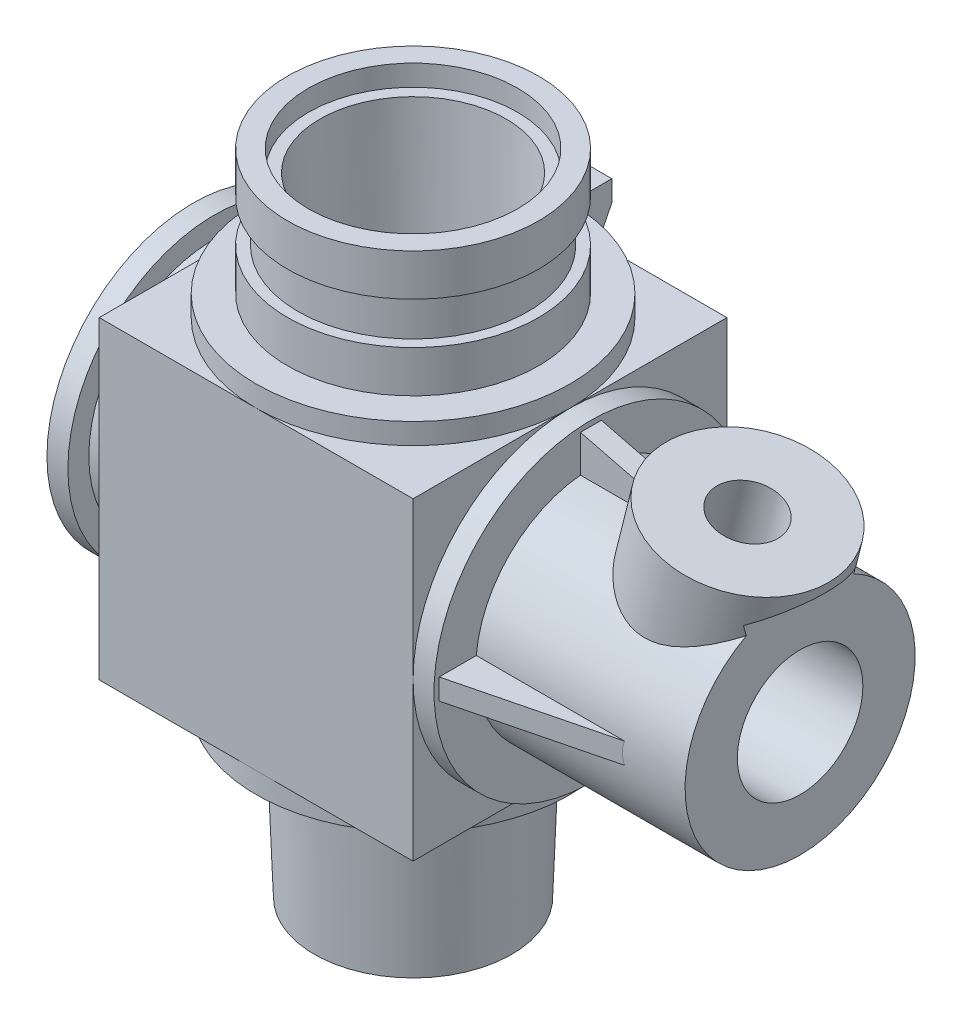
from build123d import *

# Parameters (mm, degrees)
SKETCH1_W                 = 15
SKETCH1_H                 = 15
BOSS_EXTRUDE2_DEPTH       = 15
SKETCH3_R                 = 7.5
BOSS_EXTRUDE3_DEPTH       = 1
SKETCH4_R                 = 6
BOSS_EXTRUDE4_DEPTH       = 2
SKETCH5_R                 = 5.5
BOSS_EXTRUDE5_DEPTH       = 2
SKETCH6_R                 = 6
BOSS_EXTRUDE6_DEPTH       = 2
BOSS_EXTRUDE7_START       = 1
SKETCH7_R                 = 7.5
BOSS_EXTRUDE7_DEPTH       = 1
SKETCH8_R                 = 5
BOSS_EXTRUDE8_DEPTH       = 8
BOSS_EXTRUDE8_TAPER       = 2
SKETCH9_R                 = 3.5
CUT_EXTRUDE1_DEPTH        = 21
SKETCH18_R                = 7.5
BOSS_EXTRUDE11_DEPTH      = 1
SKETCH19_R                = 5.5
BOSS_EXTRUDE12_DEPTH      = 10
SKETCH23_R                = 6
BOSS_EXTRUDE14_DEPTH      = 2
SKETCH24_R                = 7
BOSS_EXTRUDE15_DEPTH      = 1
SKETCH29_R                = 5.5
CUT_EXTRUDE5_DEPTH        = 17
SKETCH30_R                = 3
CUT_EXTRUDE6_DEPTH        = 18
SKETCH40_R                = 4.5
CUT_EXTRUDE10_DEPTH       = 11
CUT_EXTRUDE10_DRAFT       = -2.9
SKETCH41_R                = 5
CUT_EXTRUDE11_DEPTH       = 1
SKETCH42_W                = 7.5
SKETCH42_H                = 2
BOSS_EXTRUDE17_DEPTH      = 1
BOSS_EXTRUDE18_DEPTH      = 7.5
SKETCH47_R                = 3
CUT_EXTRUDE12_DEPTH       = 4
SKETCH48_R                = 1
CUT_EXTRUDE13_DEPTH       = 7
RIB2_REACH                = 34.226
SKETCH51_WALL_W           = 74.69774353
SKETCH51_WALL_H           = 1
CIRPATTERN2_COUNT         = 4
BOSS_EXTRUDE19_DEPTH      = 3
BOSS_EXTRUDE19_DEPTH_BACK = 2
SKETCH53_R                = 4
CUT_EXTRUDE15_START       = 3
SKETCH28_R                = 6
CUT_EXTRUDE15_DEPTH       = 3
SKETCH54_R                = 1.5
CUT_EXTRUDE16_DEPTH       = 7
RIB3_REACH                = 35.337
SKETCH55_WALL_W           = 72.920893998
SKETCH55_WALL_H           = 1
SKETCH56_R                = 3
CUT_EXTRUDE17_DEPTH       = 7


with BuildPart() as part:
    # Sketch1 → Boss-Extrude2 (new body)
    with BuildSketch(Plane(origin=(0, 0, 0), x_dir=(0, 0, -1), z_dir=(1, 0, 0))):
        Rectangle(SKETCH1_W, SKETCH1_H)
    extrude(amount=BOSS_EXTRUDE2_DEPTH)

    # Sketch3 → Boss-Extrude3 (add)
    with BuildSketch(Plane(origin=(0, 7.5, 0), x_dir=(1, 0, 0), z_dir=(0, 1, 0))):
        with Locations(Location((7.5, 0, 0), (0, 0, 270))):
            Circle(SKETCH3_R)
    extrude(amount=BOSS_EXTRUDE3_DEPTH)

    # Sketch4 → Boss-Extrude4 (add)
    with BuildSketch(Plane(origin=(0, 8.5, 0), x_dir=(1, 0, 0), z_dir=(0, 1, 0))):
        with Locations(Location((7.5, 0, 0), (0, 0, 270))):
            Circle(SKETCH4_R)
    extrude(amount=BOSS_EXTRUDE4_DEPTH)

    # Sketch5 → Boss-Extrude5 (add)
    with BuildSketch(Plane(origin=(0, 10.5, 0), x_dir=(1, 0, 0), z_dir=(0, 1, 0))):
        with Locations(Location((7.5, 0, 0), (0, 0, 270))):
            Circle(SKETCH5_R)
    extrude(amount=BOSS_EXTRUDE5_DEPTH)

    # Sketch6 → Boss-Extrude6 (add)
    with BuildSketch(Plane(origin=(0, 12.5, 0), x_dir=(1, 0, 0), z_dir=(0, 1, 0))):
        with Locations(Location((7.5, 0, 0), (0, 0, 270))):
            Circle(SKETCH6_R)
    extrude(amount=BOSS_EXTRUDE6_DEPTH)

    # Sketch7 → Boss-Extrude7 (add)
    with BuildSketch(Plane.XZ.offset(7.5).offset(BOSS_EXTRUDE7_START)):
        with Locations(Location((7.5, 0, 0), (0, 0, 90))):
            Circle(SKETCH7_R)
    extrude(amount=-BOSS_EXTRUDE7_DEPTH)

    # Sketch8 → Boss-Extrude8 (add)
    with BuildSketch(Plane.XZ.offset(8.5)):
        with Locations((7.5, 0)):
            Circle(SKETCH8_R)
    extrude(amount=BOSS_EXTRUDE8_DEPTH, taper=BOSS_EXTRUDE8_TAPER)

    # Sketch9 → Cut-Extrude1 (cut)
    with BuildSketch(Plane.XZ.offset(16.5)):
        with Locations(Location((7.5, 0, 0), (0, 0, 270))):
            Circle(SKETCH9_R)
    extrude(amount=-CUT_EXTRUDE1_DEPTH, mode=Mode.SUBTRACT)

    # Sketch18 → Boss-Extrude11 (add)
    with BuildSketch(Plane(origin=(15, 0, 0), x_dir=(0, 0, -1), z_dir=(1, 0, 0))):
        Circle(SKETCH18_R)
    extrude(amount=BOSS_EXTRUDE11_DEPTH)

    # Sketch19 → Boss-Extrude12 (add)
    with BuildSketch(Plane(origin=(16, 0, 0), x_dir=(0, 0, -1), z_dir=(1, 0, 0))):
        Circle(SKETCH19_R)
    extrude(amount=BOSS_EXTRUDE12_DEPTH)

    # Sketch23 → Boss-Extrude14 (add)
    with BuildSketch(Plane.ZY):
        Circle(SKETCH23_R)
    extrude(amount=BOSS_EXTRUDE14_DEPTH)

    # Sketch24 → Boss-Extrude15 (add)
    with BuildSketch(Plane.ZY.offset(2)):
        Circle(SKETCH24_R)
    extrude(amount=BOSS_EXTRUDE15_DEPTH)

    # Sketch29 → Cut-Extrude5 (cut)
    with BuildSketch(Plane.ZY.offset(3)):
        with Locations(Location((0, 0, 0), (0, 0, 180))):
            Circle(SKETCH29_R)
    extrude(amount=-CUT_EXTRUDE5_DEPTH, mode=Mode.SUBTRACT)

    # Sketch30 → Cut-Extrude6 (cut)
    with BuildSketch(Plane(origin=(26, 0, 0), x_dir=(0, 0, -1), z_dir=(1, 0, 0))):
        Circle(SKETCH30_R)
    extrude(amount=-CUT_EXTRUDE6_DEPTH, mode=Mode.SUBTRACT)


with BuildPart() as cut_extrude10_tool:
    # Sketch40 → Cut-Extrude10 (with draft: the straight prism first)
    with BuildSketch(Plane(origin=(0, 14.5, 0), x_dir=(1, 0, 0), z_dir=(0, 1, 0))):
        with Locations((7.5, 0)):
            Circle(SKETCH40_R)
    extrude(amount=-CUT_EXTRUDE10_DEPTH)
    # Cut-Extrude10: the draft: its side faces are tilted about the plane it starts from
    cut_extrude10_sides = [cut_extrude10_tool.faces().sort_by_distance(p)[0] for p in [
        (3, 9, 0),
    ]]
    draft(cut_extrude10_sides, Plane(origin=(0, 14.5, 0), x_dir=(1, 0, 0), z_dir=(0, 1, 0)), CUT_EXTRUDE10_DRAFT)


with BuildPart() as part_1:
    add(part.part)

    # Cut-Extrude10: cut by cut_extrude10_tool
    add(cut_extrude10_tool.part, mode=Mode.SUBTRACT)

    # Sketch41 → Cut-Extrude11 (cut)
    with BuildSketch(Plane(origin=(0, 14.5, 0), x_dir=(1, 0, 0), z_dir=(0, 1, 0))):
        with Locations(Location((7.5, 0, 0), (0, 0, 270))):
            Circle(SKETCH41_R)
    extrude(amount=-CUT_EXTRUDE11_DEPTH, mode=Mode.SUBTRACT)

    # Sketch42 → Boss-Extrude17 (add)
    with BuildSketch(Plane(origin=(0, 7.5, 0), x_dir=(1, 0, 0), z_dir=(0, 1, 0))):
        with BuildLine():
            Line((0, 7.5), (0, 0))
            ThreePointArc((0, 0), (2.196699141, 5.303300859), (7.5, 7.5))
            Line((7.5, 7.5), (0, 7.5))
        make_face()
        with Locations((3.75, 8.5)):
            Rectangle(SKETCH42_W, SKETCH42_H)
    extrude(amount=BOSS_EXTRUDE17_DEPTH)

    # Sketch43 → Boss-Extrude18 (add)
    with BuildSketch(Plane(origin=(7.5, 0, 0), x_dir=(0, 0, -1), z_dir=(1, 0, 0))):
        Polygon((7.5, 7.5), (7.5, 3.5), (9.5, 7.5), align=None)
    extrude(amount=-BOSS_EXTRUDE18_DEPTH)

    # Sketch46 → Revolve1 (revolve)
    with BuildSketch(Plane.ZY.offset(-2)):
        Polygon((-7.329420945, 8.15884189), (-4.646139372, 9.500482677), (-5.821757383, 11.851718699), (-8.505038956, 10.510077913), align=None)
    revolve(axis=Axis((2, 10.510077913, -8.505038956), (0, -0.8944271909999157, 0.4472135954999582)))

    # Sketch47 → Cut-Extrude12 (cut)
    with BuildSketch(Plane(origin=(0, 11.810077913, -5.905038956), x_dir=(1, 0, 0), z_dir=(0, 0.8944271909999159, -0.4472135954999583))):
        with Locations((2, 2.906888371)):
            Circle(SKETCH47_R)
    extrude(amount=-CUT_EXTRUDE12_DEPTH, mode=Mode.SUBTRACT)

    # Sketch48 → Cut-Extrude13 (cut)
    with BuildSketch(Plane(origin=(0, 8.232369149, -4.116184574), x_dir=(1, 0, 0), z_dir=(0, 0.8944271909999156, -0.44721359549995837))):
        with Locations(Location((2, 2.906888371, 0), (0, 0, 270))):
            Circle(SKETCH48_R)
    extrude(amount=-CUT_EXTRUDE13_DEPTH, mode=Mode.SUBTRACT)

    # Sketch51 wall → Rib2 (add, up to next)
    with BuildSketch(Plane(origin=(19, 0, -6.5), x_dir=(0.970142500145, 0, 0.242535625036), z_dir=(0.242535625036, 0, -0.970142500145)), mode=Mode.PRIVATE) as rib2_sk1:
        Rectangle(SKETCH51_WALL_W, SKETCH51_WALL_H)
    rib2_tool1 = extrude(rib2_sk1.sketch, amount=-RIB2_REACH, mode=Mode.PRIVATE) - part_1.part
    rib2 = rib2_tool1.solids().sort_by_distance((19, 0, -6.5))[0]
    add(rib2)

    # CirPattern2: Rib2 ×4 about axis, 1 skipped
    cirpattern2_axis = Axis((0, 0, 0), (-1, 0, 0))
    add([rib2.rotate(cirpattern2_axis, i * 360 / CIRPATTERN2_COUNT) for i in range(1, CIRPATTERN2_COUNT) if i not in (3,)])

    # Sketch53 → Boss-Extrude19 (add, two sides: drawn at the far end of the back side and taken through both)
    with BuildSketch(Plane(origin=(2.647058824, 10.588235294, 0), x_dir=(-0.9701425001453321, 0.2425356250363326, 0), z_dir=(-0.2425356250363326, -0.9701425001453321, 0)).offset(-BOSS_EXTRUDE19_DEPTH_BACK)):
        with Locations(Location((-20.979331566, 0, 0), (0, 0, 180))):
            Circle(SKETCH53_R)
    extrude(amount=BOSS_EXTRUDE19_DEPTH + BOSS_EXTRUDE19_DEPTH_BACK)

    # Sketch28 → Cut-Extrude15 (cut)
    with BuildSketch(Plane(origin=(26, 0, 0), x_dir=(0, 0, -1), z_dir=(1, 0, 0)).offset(CUT_EXTRUDE15_START)):
        with Locations(Location((0, 0, 0), (0, 0, 180))):
            Circle(SKETCH28_R)
    extrude(amount=-CUT_EXTRUDE15_DEPTH, mode=Mode.SUBTRACT)

    # Sketch54 → Cut-Extrude16 (cut)
    with BuildSketch(Plane(origin=(3.132130074, 12.528520294, 0), x_dir=(0.9701425001453321, -0.24253562503633266, 0), z_dir=(0.24253562503633266, 0.9701425001453321, 0))):
        with Locations(Location((20.979331566, 0, 0), (0, 0, 180))):
            Circle(SKETCH54_R)
    extrude(amount=-CUT_EXTRUDE16_DEPTH, mode=Mode.SUBTRACT)

    # Sketch55 wall → Rib3 (add, up to next)
    with BuildSketch(Plane(origin=(17.059715, 6.98507125, 0), x_dir=(0.970142500131, -0.242535625092, 0), z_dir=(0.242535625092, 0.970142500131, 0)), mode=Mode.PRIVATE) as rib3_sk1:
        Rectangle(SKETCH55_WALL_W, SKETCH55_WALL_H)
    rib3_tool1 = extrude(rib3_sk1.sketch, amount=-RIB3_REACH, mode=Mode.PRIVATE) - part_1.part
    add(rib3_tool1.solids().sort_by_distance((17.059715, 6.98507125, 0))[0])

    # Sketch56 → Cut-Extrude17 (cut)
    with BuildSketch(Plane(origin=(26, 0, 0), x_dir=(0, 0, -1), z_dir=(1, 0, 0))):
        Circle(SKETCH56_R)
    extrude(amount=-CUT_EXTRUDE17_DEPTH, mode=Mode.SUBTRACT)


solid = part_1.part
